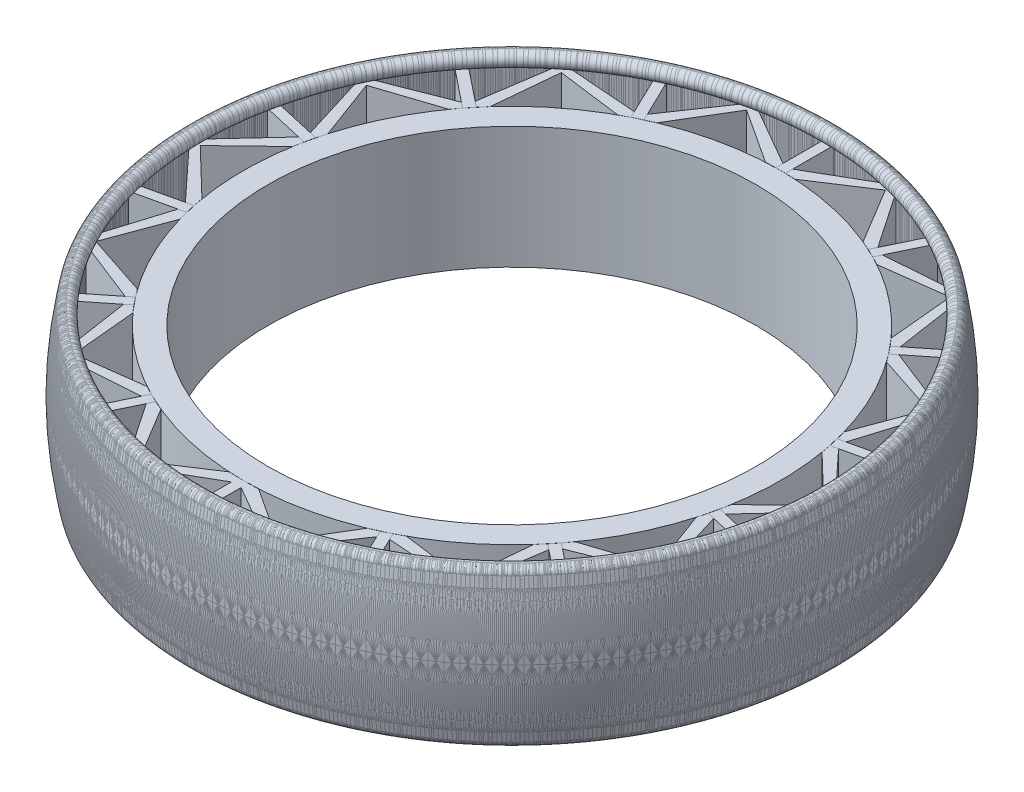
from build123d import *

# Parameters (mm, degrees)
SKETCH_1_R                = 110
SKETCH_1_R_2              = 100
EXTRUDE_1_DEPTH           = 50
EXTRUDE_2_DEPTH           = 50
PATTERN_CIRCULAR_17_COUNT = 14
EXTRUDE_5_DEPTH           = 50
PATTERN_CIRCULAR_18_COUNT = 14


with BuildPart() as part:
    # Эскиз1 → Бобышка-Вытянуть1 (new body)
    with BuildSketch(Plane(origin=(0, 0, 0), x_dir=(1, 0, 0), z_dir=(0, 1, 0))):
        with Locations(Location((0, 0, 0), (0, 0, 270))):
            Circle(SKETCH_1_R)
        with Locations(Location((0, 0, 0), (0, 0, 270))):
            Circle(SKETCH_1_R_2, mode=Mode.SUBTRACT)
    extrude(amount=EXTRUDE_1_DEPTH)


with BuildPart() as body_2:
    # Эскиз2 → Бобышка-Вытянуть2 (new body)
    with BuildSketch(Plane.XZ):
        with BuildLine():
            Line((-2, 109.981816679), (-2, 129.984614474))
            ThreePointArc((-2, 129.984614474), (0, 130), (2, 129.984614474))
            Line((2, 129.984614474), (2, 109.981816679))
            ThreePointArc((2, 109.981816679), (1.000082658, 110), (0, 110))
            ThreePointArc((0, 110), (-1.000082658, 110), (-2, 109.981816679))
        make_face()
    extrude(amount=-EXTRUDE_2_DEPTH)

    # Эскиз5 → Повернуть2 (revolve)
    with BuildSketch(Plane(origin=(0, 0, 0), x_dir=(0, 0, -1), z_dir=(1, 0, 0)), mode=Mode.PRIVATE) as revolve_2_sk:
        with BuildLine():
            ThreePointArc((-132.707074589, -0.423409954), (-134.387608631, 12.239761433), (-134.984614474, 25))
            ThreePointArc((-134.984614474, 25), (-134.387608631, 37.760238567), (-132.707074589, 50.423409954))
            Line((-132.707074589, 50.423409954), (-131.984614474, 54.52068487))
            ThreePointArc((-131.984614474, 54.52068487), (-126.743081422, 55.941164761), (-128.996008659, 50.999935084))
            ThreePointArc((-128.996008659, 50.999935084), (-129.695738298, 50.703066787), (-129.984614474, 50))
            Line((-129.984614474, 50), (-129.984614474, 0))
            ThreePointArc((-129.984614474, 0), (-129.695738298, -0.703066787), (-128.996008659, -0.999935084))
            ThreePointArc((-128.996008659, -0.999935084), (-126.743081422, -5.941164761), (-131.984614474, -4.52068487))
            Line((-131.984614474, -4.52068487), (-132.707074589, -0.423409954))
        make_face()
    revolve(revolve_2_sk.sketch.rotate(Axis((0, 0, 0), (0, 1, 0)), 180), axis=Axis((0, 0, 0), (0, 1, 0)))


with BuildPart() as pattern_circular_17_1:
    # Круговой массив17: pattern copy
    add(body_2.part.rotate(Axis((0, 0, 0), (0, 1, 0)), 1 * 360 / PATTERN_CIRCULAR_17_COUNT))


with BuildPart() as pattern_circular_17_2:
    # Круговой массив17: pattern copy
    add(body_2.part.rotate(Axis((0, 0, 0), (0, 1, 0)), 2 * 360 / PATTERN_CIRCULAR_17_COUNT))


with BuildPart() as pattern_circular_17_3:
    # Круговой массив17: pattern copy
    add(body_2.part.rotate(Axis((0, 0, 0), (0, 1, 0)), 3 * 360 / PATTERN_CIRCULAR_17_COUNT))


with BuildPart() as pattern_circular_17_4:
    # Круговой массив17: pattern copy
    add(body_2.part.rotate(Axis((0, 0, 0), (0, 1, 0)), 4 * 360 / PATTERN_CIRCULAR_17_COUNT))


with BuildPart() as pattern_circular_17_5:
    # Круговой массив17: pattern copy
    add(body_2.part.rotate(Axis((0, 0, 0), (0, 1, 0)), 5 * 360 / PATTERN_CIRCULAR_17_COUNT))


with BuildPart() as pattern_circular_17_6:
    # Круговой массив17: pattern copy
    add(body_2.part.rotate(Axis((0, 0, 0), (0, 1, 0)), 6 * 360 / PATTERN_CIRCULAR_17_COUNT))


with BuildPart() as pattern_circular_17_7:
    # Круговой массив17: pattern copy
    add(body_2.part.rotate(Axis((0, 0, 0), (0, 1, 0)), 7 * 360 / PATTERN_CIRCULAR_17_COUNT))


with BuildPart() as pattern_circular_17_8:
    # Круговой массив17: pattern copy
    add(body_2.part.rotate(Axis((0, 0, 0), (0, 1, 0)), 8 * 360 / PATTERN_CIRCULAR_17_COUNT))


with BuildPart() as pattern_circular_17_9:
    # Круговой массив17: pattern copy
    add(body_2.part.rotate(Axis((0, 0, 0), (0, 1, 0)), 9 * 360 / PATTERN_CIRCULAR_17_COUNT))


with BuildPart() as pattern_circular_17_10:
    # Круговой массив17: pattern copy
    add(body_2.part.rotate(Axis((0, 0, 0), (0, 1, 0)), 10 * 360 / PATTERN_CIRCULAR_17_COUNT))


with BuildPart() as pattern_circular_17_11:
    # Круговой массив17: pattern copy
    add(body_2.part.rotate(Axis((0, 0, 0), (0, 1, 0)), 11 * 360 / PATTERN_CIRCULAR_17_COUNT))


with BuildPart() as pattern_circular_17_12:
    # Круговой массив17: pattern copy
    add(body_2.part.rotate(Axis((0, 0, 0), (0, 1, 0)), 12 * 360 / PATTERN_CIRCULAR_17_COUNT))


with BuildPart() as pattern_circular_17_13:
    # Круговой массив17: pattern copy
    add(body_2.part.rotate(Axis((0, 0, 0), (0, 1, 0)), 13 * 360 / PATTERN_CIRCULAR_17_COUNT))


with BuildPart() as body_2_1:
    add(body_2.part)

    # Эскиз4 → Бобышка-Вытянуть5 (add)
    with BuildSketch(Plane.XZ):
        with BuildLine():
            Line((-31.060325091, 126.234924665), (-6, 109.836241742))
            ThreePointArc((-6, 109.836241742), (-4.000662197, 109.927224571), (-2, 109.981816679))
            Line((-2, 109.981816679), (-2, 112.981816679))
            Line((-2, 112.981816679), (-26.682475102, 127.232250324))
            ThreePointArc((-26.682475102, 127.232250324), (-28.875706193, 126.75248949), (-31.060325091, 126.234924665))
        make_face()
        with BuildLine():
            Line((31.060325091, 126.234924665), (6, 109.836241742))
            ThreePointArc((6, 109.836241742), (4.000662197, 109.927224571), (2, 109.981816679))
            Line((2, 109.981816679), (2, 112.981816679))
            Line((2, 112.981816679), (26.682475102, 127.232250324))
            ThreePointArc((26.682475102, 127.232250324), (28.875706193, 126.75248949), (31.060325091, 126.234924665))
        make_face()
    extrude_5 = extrude(amount=-EXTRUDE_5_DEPTH)

    # Круговой массив18: Бобышка-Вытянуть5 ×14 about axis
    pattern_circular_18_axis = Axis((0, 0, 0), (0, 1, 0))
    for i in range(1, PATTERN_CIRCULAR_18_COUNT):
        add(extrude_5.rotate(pattern_circular_18_axis, i * 360 / PATTERN_CIRCULAR_18_COUNT))


solid = Compound([part.part, pattern_circular_17_1.part, pattern_circular_17_2.part, pattern_circular_17_3.part, pattern_circular_17_4.part, pattern_circular_17_5.part, pattern_circular_17_6.part, pattern_circular_17_7.part, pattern_circular_17_8.part, pattern_circular_17_9.part, pattern_circular_17_10.part, pattern_circular_17_11.part, pattern_circular_17_12.part, pattern_circular_17_13.part, body_2_1.part])
